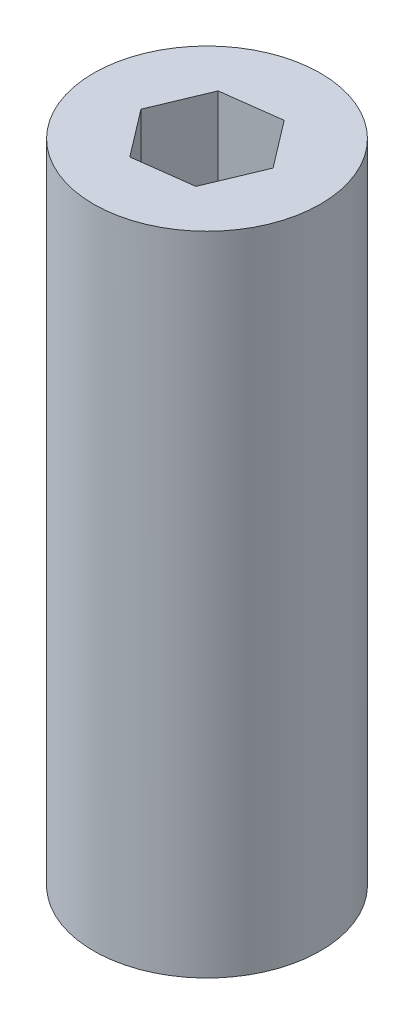
from build123d import *

# Parameters (mm, degrees)
SKETCH1_R           = 5
BOSS_EXTRUDE1_DEPTH = 8
BOSS_EXTRUDE2_START = 6
SKETCH2_R           = 5
SKETCH2_R_2         = 2.175
BOSS_EXTRUDE2_DEPTH = 6
BOSS_EXTRUDE3_START = 1.5
SKETCH3_R           = 5
BOSS_EXTRUDE3_DEPTH = 1.5
BOSS_EXTRUDE4_START = 13
SKETCH4_R           = 5
BOSS_EXTRUDE4_DEPTH = 13


with BuildPart() as part:
    # Sketch1 → Boss-Extrude1 (new body)
    with BuildSketch(Plane(origin=(0, 0, 0), x_dir=(1, 0, 0), z_dir=(0, 1, 0))):
        with Locations(Location((0, 0, 0), (0, 0, 270))):
            Circle(SKETCH1_R)
        Polygon((1.577657476, -2.066639032), (2.57859064, 0.332971936), (1.000933165, 2.399610968), (-1.577657476, 2.066639032), (-2.57859064, -0.332971936), (-1.000933165, -2.399610968), align=None, mode=Mode.SUBTRACT)
    extrude(amount=BOSS_EXTRUDE1_DEPTH)

    # Sketch2 → Boss-Extrude2 (add)
    with BuildSketch(Plane.XZ.offset(BOSS_EXTRUDE2_START)):
        with Locations(Location((0, 0, 0), (0, 0, 270))):
            Circle(SKETCH2_R)
        with Locations(Location((0, 0, 0), (0, 0, 270))):
            Circle(SKETCH2_R_2, mode=Mode.SUBTRACT)
    extrude(amount=-BOSS_EXTRUDE2_DEPTH)

    # Sketch3 → Boss-Extrude3 (add)
    with BuildSketch(Plane.XZ.offset(6).offset(BOSS_EXTRUDE3_START)):
        with Locations(Location((0, 0, 0), (0, 0, 270))):
            Circle(SKETCH3_R)
    extrude(amount=-BOSS_EXTRUDE3_DEPTH)

    # Sketch4 → Boss-Extrude4 (add)
    with BuildSketch(Plane.XZ.offset(7.5).offset(BOSS_EXTRUDE4_START)):
        with Locations(Location((0, 0, 0), (0, 0, 270))):
            Circle(SKETCH4_R)
        with BuildLine():
            Line((-1.747140521, 2.5), (1.747140521, 2.5))
            ThreePointArc((1.747140521, 2.5), (0, -3.05), (-1.747140521, 2.5))
        make_face(mode=Mode.SUBTRACT)
    extrude(amount=-BOSS_EXTRUDE4_DEPTH)


solid = part.part
